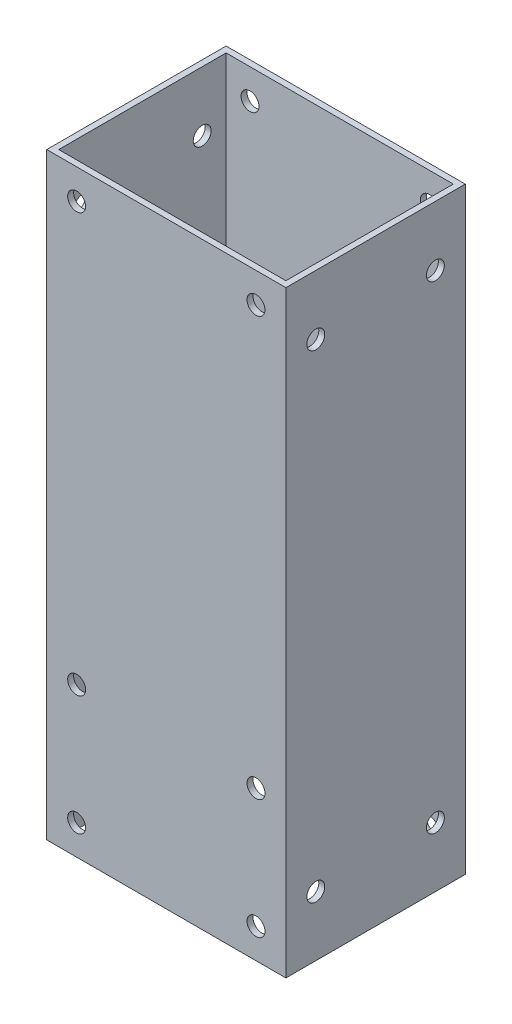
from build123d import *

# Parameters (mm, degrees)
SKETCH_1_W          = 40
SKETCH_1_H          = 30
SKETCH_1_W_2        = 38
SKETCH_1_H_2        = 28
EXTRUDE_1_DEPTH     = 100
SKETCH_2_R          = 1.5
CUT_EXTRUDE_1_DEPTH = 112.803398875
SKETCH_3_R          = 1.5
CUT_EXTRUDE_2_DEPTH = 112.803398875


with BuildPart() as part:
    # 草图1 → 拉伸-薄壁1 (new body)
    with BuildSketch(Plane(origin=(0, 0, 0), x_dir=(1, 0, 0), z_dir=(0, 1, 0))):
        with Locations((20, 15)):
            Rectangle(SKETCH_1_W, SKETCH_1_H)
        with Locations((20, 15)):
            Rectangle(SKETCH_1_W_2, SKETCH_1_H_2, mode=Mode.SUBTRACT)
    extrude(amount=EXTRUDE_1_DEPTH)

    # 草图2 → 切除-拉伸1 (cut, through all)
    with BuildSketch(Plane.XY):
        with Locations((5, 95)):
            Circle(SKETCH_2_R)
        with Locations((35, 95)):
            Circle(SKETCH_2_R)
        with Locations((35, 25)):
            Circle(SKETCH_2_R)
        with Locations((5, 25)):
            Circle(SKETCH_2_R)
        with Locations((5, 5)):
            Circle(SKETCH_2_R)
        with Locations((35, 5)):
            Circle(SKETCH_2_R)
    extrude(amount=-CUT_EXTRUDE_1_DEPTH, mode=Mode.SUBTRACT)

    # 草图3 → 切除-拉伸2 (cut, through all)
    with BuildSketch(Plane.ZY):
        with Locations((-25, 90)):
            Circle(SKETCH_3_R)
        with Locations((-5, 90)):
            Circle(SKETCH_3_R)
        with Locations((-25, 10)):
            Circle(SKETCH_3_R)
        with Locations((-5, 10)):
            Circle(SKETCH_3_R)
    extrude(amount=-CUT_EXTRUDE_2_DEPTH, mode=Mode.SUBTRACT)


solid = part.part
